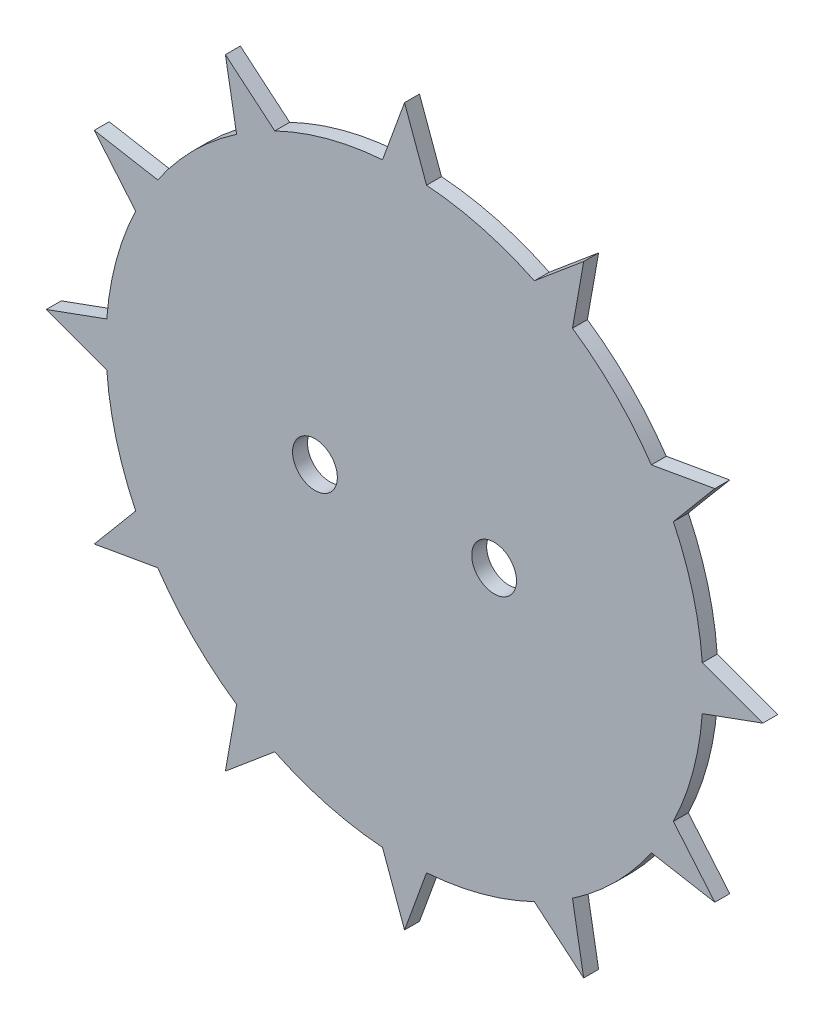
from build123d import *

# Parameters (mm, degrees)
CROQUIS1_R              = 20
SALIENTE_EXTRUIR1_DEPTH = 1
SALIENTE_EXTRUIR2_DEPTH = 1
CORTAR_EXTRUIR1_REACH   = 35.956
CROQUIS4_R              = 1.5


with BuildPart() as part:
    # Croquis1 → Saliente-Extruir1 (new body)
    with BuildSketch(Plane(origin=(0, 0, 0), x_dir=(0, 1, 0), z_dir=(0, 0, 1))):
        with Locations(Location((0, 0, 0), (0, 0, 270))):
            Circle(CROQUIS1_R)
    extrude(amount=SALIENTE_EXTRUIR1_DEPTH)

    # Croquis2 → Saliente-Extruir2 (add)
    with BuildSketch(Plane(origin=(0, 0, 0), x_dir=(0, 1, 0), z_dir=(0, 0, 1))):
        with BuildLine():
            Line((0, -24), (1.47572399, -19.945481661))
            ThreePointArc((1.47572399, -19.945481661), (0, -20), (-1.47572399, -19.945481661))
            Line((-1.47572399, -19.945481661), (0, -24))
        make_face()
        with BuildLine():
            Line((-12, -20.784609691), (-8.694726367, -18.011155804))
            ThreePointArc((-8.694726367, -18.011155804), (-10, -17.320508076), (-11.250755295, -16.535431815))
            Line((-11.250755295, -16.535431815), (-12, -20.784609691))
        make_face()
        with BuildLine():
            Line((-20.784609691, -12), (-16.535431815, -11.250755295))
            ThreePointArc((-16.535431815, -11.250755295), (-17.320508076, -10), (-18.011155804, -8.694726367))
            Line((-18.011155804, -8.694726367), (-20.784609691, -12))
        make_face()
        with BuildLine():
            Line((-24, 0), (-19.945481661, -1.47572399))
            ThreePointArc((-19.945481661, -1.47572399), (-20, 0), (-19.945481661, 1.47572399))
            Line((-19.945481661, 1.47572399), (-24, 0))
        make_face()
        with BuildLine():
            Line((-20.784609691, 12), (-18.011155804, 8.694726367))
            ThreePointArc((-18.011155804, 8.694726367), (-17.320508076, 10), (-16.535431815, 11.250755295))
            Line((-16.535431815, 11.250755295), (-20.784609691, 12))
        make_face()
        with BuildLine():
            Line((-12, 20.784609691), (-11.250755295, 16.535431815))
            ThreePointArc((-11.250755295, 16.535431815), (-10, 17.320508076), (-8.694726367, 18.011155804))
            Line((-8.694726367, 18.011155804), (-12, 20.784609691))
        make_face()
        with BuildLine():
            Line((0, 24), (-1.47572399, 19.945481661))
            ThreePointArc((-1.47572399, 19.945481661), (0, 20), (1.47572399, 19.945481661))
            Line((1.47572399, 19.945481661), (0, 24))
        make_face()
        with BuildLine():
            Line((12, 20.784609691), (8.694726367, 18.011155804))
            ThreePointArc((8.694726367, 18.011155804), (10, 17.320508076), (11.250755295, 16.535431815))
            Line((11.250755295, 16.535431815), (12, 20.784609691))
        make_face()
        with BuildLine():
            Line((20.784609691, 12), (16.535431815, 11.250755295))
            ThreePointArc((16.535431815, 11.250755295), (17.320508076, 10), (18.011155804, 8.694726367))
            Line((18.011155804, 8.694726367), (20.784609691, 12))
        make_face()
        with BuildLine():
            Line((24, 0), (19.945481661, 1.47572399))
            ThreePointArc((19.945481661, 1.47572399), (20, 0), (19.945481661, -1.47572399))
            Line((19.945481661, -1.47572399), (24, 0))
        make_face()
        with BuildLine():
            Line((20.784609691, -12), (18.011155804, -8.694726367))
            ThreePointArc((18.011155804, -8.694726367), (17.320508076, -10), (16.535431815, -11.250755295))
            Line((16.535431815, -11.250755295), (20.784609691, -12))
        make_face()
        with BuildLine():
            Line((12, -20.784609691), (11.250755295, -16.535431815))
            ThreePointArc((11.250755295, -16.535431815), (10, -17.320508076), (8.694726367, -18.011155804))
            Line((8.694726367, -18.011155804), (12, -20.784609691))
        make_face()
    extrude(amount=SALIENTE_EXTRUIR2_DEPTH)

    # Croquis4 → Cortar-Extruir1 (cut, up to next)
    with BuildSketch(Plane.XY.offset(1), mode=Mode.PRIVATE) as cortar_extruir1_sk1:
        with Locations((6, 0)):
            Circle(CROQUIS4_R)
    cortar_extruir1_tool1 = extrude(cortar_extruir1_sk1.sketch, amount=-CORTAR_EXTRUIR1_REACH, mode=Mode.PRIVATE) & part.part
    # Croquis4 → Cortar-Extruir1 (cut, up to next)
    with BuildSketch(Plane.XY.offset(1), mode=Mode.PRIVATE) as cortar_extruir1_sk2:
        with Locations((-6, 0)):
            Circle(CROQUIS4_R)
    cortar_extruir1_tool2 = extrude(cortar_extruir1_sk2.sketch, amount=-CORTAR_EXTRUIR1_REACH, mode=Mode.PRIVATE) & part.part
    add(cortar_extruir1_tool1.solids().sort_by_distance((6, 0, 1))[0], mode=Mode.SUBTRACT)
    add(cortar_extruir1_tool2.solids().sort_by_distance((-6, 0, 1))[0], mode=Mode.SUBTRACT)


solid = part.part
